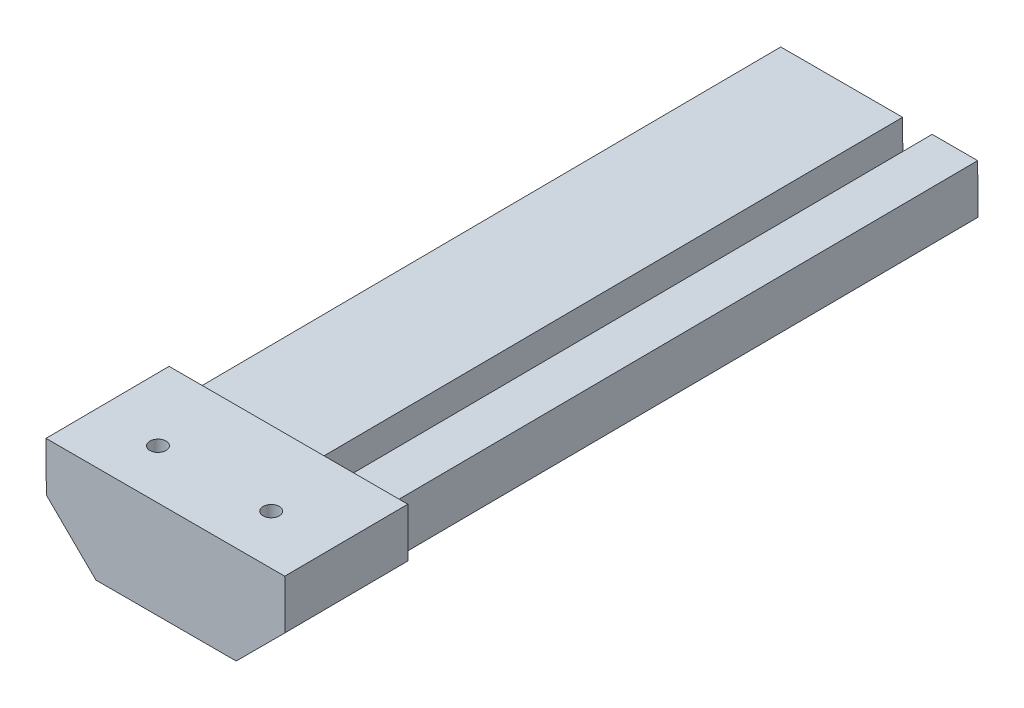
from build123d import *

# Parameters (mm, degrees)
EXTRUDE_1_DEPTH              = 120
SKETCH_2_W                   = 48.5
SKETCH_2_H                   = 20
EXTRUDE_2_DEPTH              = 25
HOLE_WIZARD_M4_1_D           = 3.3
HOLE_WIZARD_M4_1_ON_FACE_2_D = 3.3
CUT_EXTRUDE_1_REACH          = 161.463


with BuildPart() as part:
    # 草图1 → 凸台-拉伸1 (new body)
    with BuildSketch(Plane(origin=(0, 51.506568262, -7630.363691544), x_dir=(1, 0, 0), z_dir=(0, -0.006750057654754126, 0.9999772181013213))):
        Polygon((28.350451638, 9.735119508), (36.350451638, 9.735119508), (36.350451638, 24.735119508), (16.350451638, 24.735119508), (16.350451638, 14.735119508), (28.350451638, 14.735119508), align=None)
        Polygon((36.350451638, 24.735119508), (36.350451638, 9.735119508), (44.350451638, 9.735119508), (44.350451638, 14.735119508), (56.350451638, 14.735119508), (56.350451638, 24.735119508), (47.100400838, 24.735119508), (47.100400838, 22.735119508), (47.100400838, 17.735119508), (41.100400838, 17.735119508), (41.100400838, 22.735119508), (41.100400838, 24.735119508), align=None)
    extrude(amount=-EXTRUDE_1_DEPTH)

    # 草图2 → 凸台-拉伸2 (add)
    with BuildSketch(Plane(origin=(0, 51.506568262, -7630.363691544), x_dir=(1, 0, 0), z_dir=(0, -0.00675005765475416, 0.9999772181013213))):
        with Locations((36.350451638, 17.235119507)):
            Rectangle(SKETCH_2_W, SKETCH_2_H)
    extrude(amount=EXTRUDE_2_DEPTH)

    # M4 螺纹孔1 (through all)
    with Locations(Plane(origin=(47.850451638, 78.639816437, -7615.180194646), x_dir=(0, -0.006750057655, 0.999977218101), z_dir=(0, 0.999977218101, 0.006750057655))):
        with Locations((0, 0)):
            Hole(HOLE_WIZARD_M4_1_D / 2)

    # M4 螺纹孔1 on face 2 (through all)
    with Locations(Plane(origin=(24.850451638, 78.639816437, -7615.180194646), x_dir=(0, -0.006750001475, 0.999977218481), z_dir=(0, 0.999977218481, 0.006750001475))):
        with Locations((0, 0)):
            Hole(HOLE_WIZARD_M4_1_ON_FACE_2_D / 2)

    # 草图5 → 切除-拉伸1 (cut, up to next)
    with BuildSketch(Plane(origin=(0, 51.337816821, -7605.364261092), x_dir=(1, 0, 0), z_dir=(0, -0.0067500576547363505, 0.9999772181013213)), mode=Mode.PRIVATE) as cut_extrude_1_sk1:
        Polygon((12.100451638, 17.235119508), (22.100451638, 7.235119508), (12.100451638, 7.235119508), align=None)
    cut_extrude_1_tool1 = extrude(cut_extrude_1_sk1.sketch, amount=-CUT_EXTRUDE_1_REACH, mode=Mode.PRIVATE) & part.part
    # 草图5 → 切除-拉伸1 (cut, up to next)
    with BuildSketch(Plane(origin=(0, 51.337816821, -7605.364261092), x_dir=(1, 0, 0), z_dir=(0, -0.0067500576547363505, 0.9999772181013213)), mode=Mode.PRIVATE) as cut_extrude_1_sk2:
        Polygon((60.600451638, 17.235119508), (50.600451638, 7.235119508), (60.600451638, 7.235119508), align=None)
    cut_extrude_1_tool2 = extrude(cut_extrude_1_sk2.sketch, amount=-CUT_EXTRUDE_1_REACH, mode=Mode.PRIVATE) & part.part
    add(cut_extrude_1_tool1.solids().sort_by_distance((15.433785, 61.906029, -7605.292923))[0], mode=Mode.SUBTRACT)
    add(cut_extrude_1_tool2.solids().sort_by_distance((57.267118, 61.906029, -7605.292923))[0], mode=Mode.SUBTRACT)


solid = part.part
